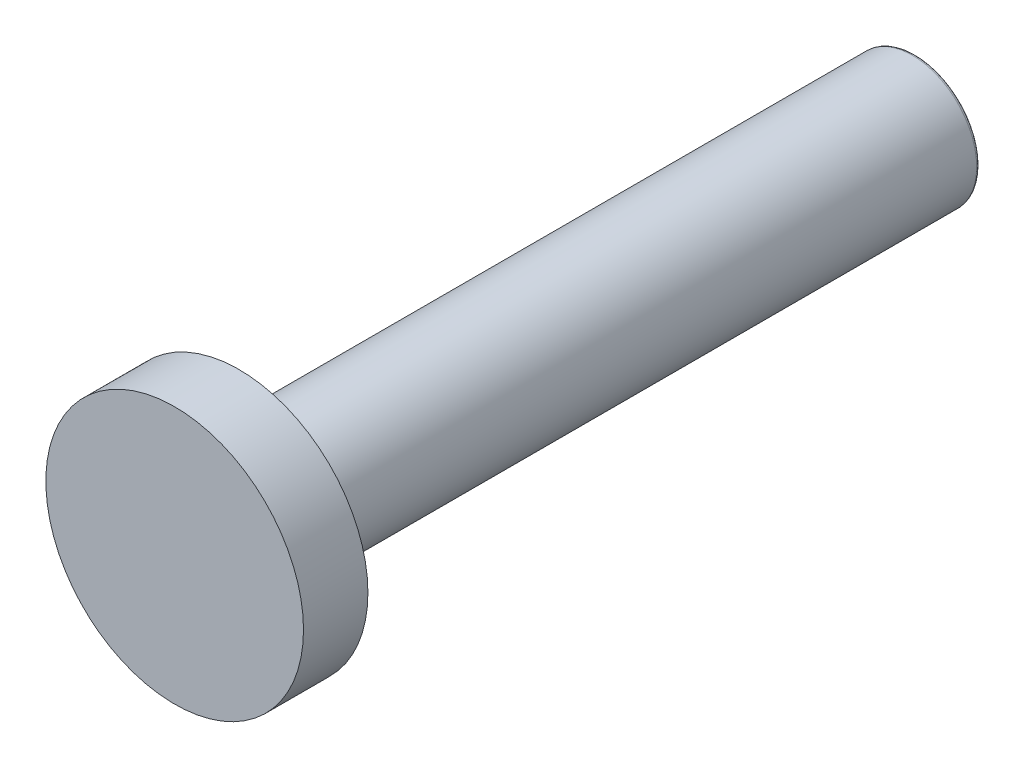
from build123d import *


with BuildPart() as part:
    # Sketch1 → Revolve1 (revolve)
    with BuildSketch(Plane(origin=(0, 0, 0), x_dir=(1, 0, 0), z_dir=(0, 1, 0))):
        with BuildLine():
            Line((1.8, 0), (0, 0))
            Line((0, 0), (0, -21.789473684))
            Line((0, -21.789473684), (3.789473684, -21.789473684))
            Line((3.789473684, -21.789473684), (3.789473684, -19.894736842))
            Line((3.789473684, -19.894736842), (1.894736842, -19.894736842))
            Line((1.894736842, -19.894736842), (1.894736842, -0.094736842))
            ThreePointArc((1.894736842, -0.094736842), (1.866989063, -0.027747779), (1.8, 0))
        make_face()
    revolve(axis=Axis((0, 0, 0), (0, 0, 1)))


solid = part.part
